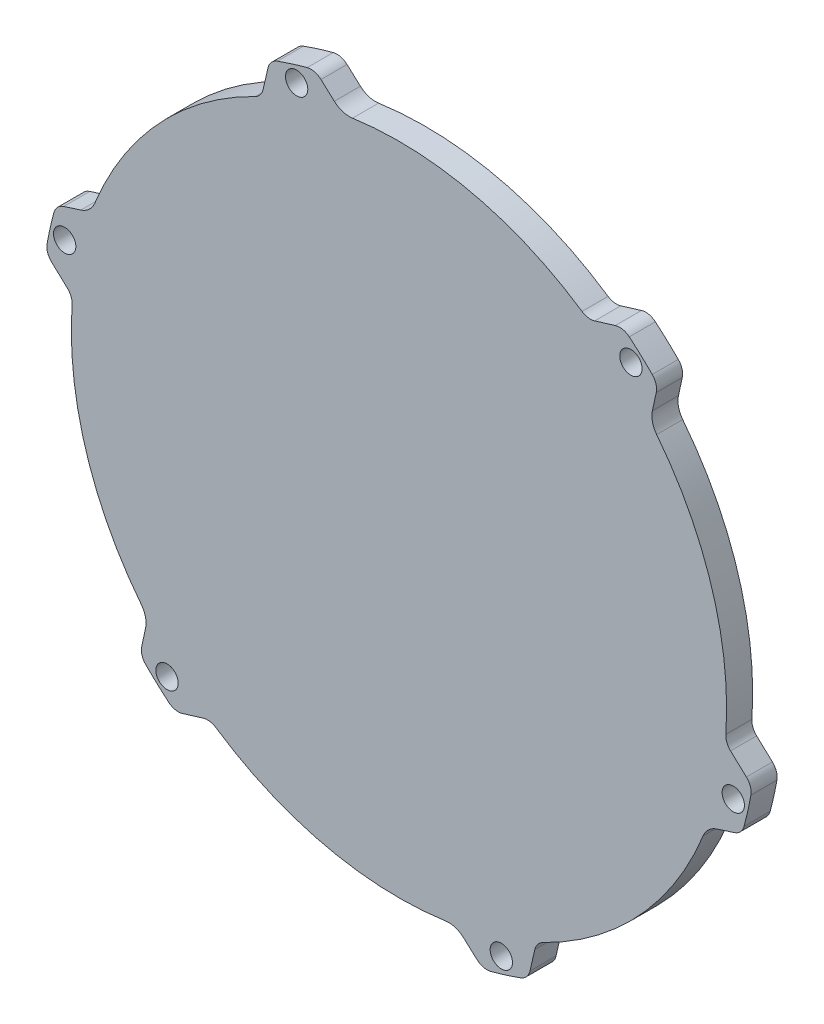
from build123d import *

# Parameters (mm, degrees)
SKETCH2_R             = 39.4
BOSS_EXTRUDE1_DEPTH   = 2
SKETCH2_R_2           = 1.5
SKETCH2_R_3           = 42
BOSS_EXTRUDE1_2_DEPTH = 2
SKETCH3_R             = 1.5
BOSS_EXTRUDE2_DEPTH   = 1.5
SKETCH4_R             = 37
CUT_EXTRUDE1_DEPTH    = 2


with BuildPart() as part:
    # Sketch2 → Boss-Extrude1 (new body)
    with BuildSketch(Plane.XY):
        Circle(SKETCH2_R)
    extrude(amount=BOSS_EXTRUDE1_DEPTH)



with BuildPart() as body_2:
    # Sketch2 → Boss-Extrude1 2 (new body)
    with BuildSketch(Plane.XY):
        with BuildLine():
            Line((-45.018479974, 13.897886094), (-42.708823016, 14.636743864))
            ThreePointArc((-42.708823016, 14.636743864), (-41.579055756, 15.298025015), (-40.838449582, 16.377455105))
            ThreePointArc((-40.838449582, 16.377455105), (-32.228172293, 29.955715826), (-19.314601011, 39.534114228))
            ThreePointArc((-19.314601011, 39.534114228), (-18.626580504, 40.087021781), (-18.243561026, 40.882241915))
            Line((-18.243561026, 40.882241915), (-17.592978184, 43.707000534))
            ThreePointArc((-17.592978184, 43.707000534), (-17.140898521, 44.584509163), (-16.324175781, 45.138910987))
            ThreePointArc((-16.324175781, 45.138910987), (-14.341791733, 45.80734668), (-12.332164177, 46.388767247))
            ThreePointArc((-12.332164177, 46.388767247), (-11.345102668, 46.399111036), (-10.473317571, 45.936090345))
            Line((-10.473317571, 45.936090345), (-8.678619493, 44.30529763))
            ThreePointArc((-8.678619493, 44.30529763), (-7.541049587, 43.657531057), (-6.235932621, 43.555862342))
            ThreePointArc((-6.235932621, 43.555862342), (9.828324748, 42.888273836), (24.580246732, 36.493992253))
            ThreePointArc((24.580246732, 36.493992253), (25.403088973, 36.174602792), (26.283279549, 36.240508262))
            Line((26.283279549, 36.240508262), (29.054883694, 37.089466303))
            ThreePointArc((29.054883694, 37.089466303), (30.04086829, 37.136708144), (30.929355724, 36.706606415))
            ThreePointArc((30.929355724, 36.706606415), (32.499430039, 35.324029316), (34.007768798, 33.874351084))
            ThreePointArc((34.007768798, 33.874351084), (34.510257536, 33.024702637), (34.545162404, 32.03820425))
            Line((34.545162404, 32.03820425), (34.030203523, 29.668553765))
            ThreePointArc((34.030203523, 29.668553765), (34.038006169, 28.359506042), (34.602516962, 27.178407237))
            ThreePointArc((34.602516962, 27.178407237), (42.05649704, 12.93255801), (43.894847743, -3.040121975))
            ThreePointArc((43.894847743, -3.040121975), (44.029669477, -3.912418989), (44.526840575, -4.641733653))
            Line((44.526840575, -4.641733653), (46.647861878, -6.617534232))
            ThreePointArc((46.647861878, -6.617534232), (47.181766811, -7.447801019), (47.253531504, -8.432304572))
            ThreePointArc((47.253531504, -8.432304572), (46.841221772, -10.483317364), (46.339932975, -12.514416163))
            ThreePointArc((46.339932975, -12.514416163), (45.855360204, -13.374408399), (45.018479974, -13.897886094))
            Line((45.018479974, -13.897886094), (42.708823016, -14.636743864))
            ThreePointArc((42.708823016, -14.636743864), (41.579055756, -15.298025015), (40.838449582, -16.377455105))
            ThreePointArc((40.838449582, -16.377455105), (32.228172293, -29.955715826), (19.314601011, -39.534114228))
            ThreePointArc((19.314601011, -39.534114228), (18.626580504, -40.087021781), (18.243561026, -40.882241915))
            Line((18.243561026, -40.882241915), (17.592978184, -43.707000534))
            ThreePointArc((17.592978184, -43.707000534), (17.140898521, -44.584509163), (16.324175781, -45.138910987))
            ThreePointArc((16.324175781, -45.138910987), (14.341791733, -45.80734668), (12.332164177, -46.388767247))
            ThreePointArc((12.332164177, -46.388767247), (11.345102668, -46.399111036), (10.473317571, -45.936090345))
            Line((10.473317571, -45.936090345), (8.678619493, -44.30529763))
            ThreePointArc((8.678619493, -44.30529763), (7.541049587, -43.657531057), (6.235932621, -43.555862342))
            ThreePointArc((6.235932621, -43.555862342), (-9.828324748, -42.888273836), (-24.580246732, -36.493992253))
            ThreePointArc((-24.580246732, -36.493992253), (-25.403088973, -36.174602792), (-26.283279549, -36.240508262))
            Line((-26.283279549, -36.240508262), (-29.054883694, -37.089466303))
            ThreePointArc((-29.054883694, -37.089466303), (-30.04086829, -37.136708144), (-30.929355724, -36.706606415))
            ThreePointArc((-30.929355724, -36.706606415), (-32.499430039, -35.324029316), (-34.007768798, -33.874351084))
            ThreePointArc((-34.007768798, -33.874351084), (-34.510257536, -33.024702637), (-34.545162404, -32.03820425))
            Line((-34.545162404, -32.03820425), (-34.030203523, -29.668553765))
            ThreePointArc((-34.030203523, -29.668553765), (-34.038006169, -28.359506042), (-34.602516962, -27.178407237))
            ThreePointArc((-34.602516962, -27.178407237), (-42.05649704, -12.93255801), (-43.894847743, 3.040121975))
            ThreePointArc((-43.894847743, 3.040121975), (-44.029669477, 3.912418989), (-44.526840575, 4.641733653))
            Line((-44.526840575, 4.641733653), (-46.647861878, 6.617534232))
            ThreePointArc((-46.647861878, 6.617534232), (-47.181766811, 7.447801019), (-47.253531504, 8.432304572))
            ThreePointArc((-47.253531504, 8.432304572), (-46.841221772, 10.483317364), (-46.339932975, 12.514416163))
            ThreePointArc((-46.339932975, 12.514416163), (-45.855360204, 13.374408399), (-45.018479974, 13.897886094))
        make_face()
        with Locations((-13.744217077, 43.898707235)):
            Circle(SKETCH2_R_2, mode=Mode.SUBTRACT)
        with Locations((-44.889504198, 10.046512474)):
            Circle(SKETCH2_R_2, mode=Mode.SUBTRACT)
        with Locations((31.145287121, 33.852194762)):
            Circle(SKETCH2_R_2, mode=Mode.SUBTRACT)
        with Locations((44.889504198, -10.046512474)):
            Circle(SKETCH2_R_2, mode=Mode.SUBTRACT)
        with Locations((13.744217077, -43.898707235)):
            Circle(SKETCH2_R_2, mode=Mode.SUBTRACT)
        with Locations((-31.145287121, -33.852194762)):
            Circle(SKETCH2_R_2, mode=Mode.SUBTRACT)
        Circle(SKETCH2_R_3, mode=Mode.SUBTRACT)
    extrude(amount=BOSS_EXTRUDE1_2_DEPTH)


with BuildPart() as part_1:
    add(part.part)

    add(body_2.part)  # Boss-Extrude2 merges body 2
    # Sketch3 → Boss-Extrude2 (add)
    with BuildSketch(Plane.XY.offset(2)):
        with BuildLine():
            Line((8.678619493, -44.30529763), (10.473317571, -45.936090345))
            ThreePointArc((10.473317571, -45.936090345), (11.345102668, -46.399111036), (12.332164177, -46.388767247))
            ThreePointArc((12.332164177, -46.388767247), (14.341791733, -45.80734668), (16.324175781, -45.138910987))
            ThreePointArc((16.324175781, -45.138910987), (17.140898521, -44.584509163), (17.592978184, -43.707000534))
            Line((17.592978184, -43.707000534), (18.243561026, -40.882241915))
            ThreePointArc((18.243561026, -40.882241915), (18.626580504, -40.087021781), (19.314601011, -39.534114228))
            ThreePointArc((19.314601011, -39.534114228), (32.228172293, -29.955715826), (40.838449582, -16.377455105))
            ThreePointArc((40.838449582, -16.377455105), (41.579055756, -15.298025015), (42.708823016, -14.636743864))
            Line((42.708823016, -14.636743864), (45.018479974, -13.897886094))
            ThreePointArc((45.018479974, -13.897886094), (45.855360204, -13.374408399), (46.339932975, -12.514416163))
            ThreePointArc((46.339932975, -12.514416163), (46.841221772, -10.483317364), (47.253531504, -8.432304572))
            ThreePointArc((47.253531504, -8.432304572), (47.181766811, -7.447801019), (46.647861878, -6.617534232))
            Line((46.647861878, -6.617534232), (44.526840575, -4.641733653))
            ThreePointArc((44.526840575, -4.641733653), (44.029669477, -3.912418989), (43.894847743, -3.040121975))
            ThreePointArc((43.894847743, -3.040121975), (42.05649704, 12.93255801), (34.602516962, 27.178407237))
            ThreePointArc((34.602516962, 27.178407237), (34.038006169, 28.359506042), (34.030203523, 29.668553765))
            Line((34.030203523, 29.668553765), (34.545162404, 32.03820425))
            ThreePointArc((34.545162404, 32.03820425), (34.510257536, 33.024702637), (34.007768798, 33.874351084))
            ThreePointArc((34.007768798, 33.874351084), (32.499430039, 35.324029316), (30.929355724, 36.706606415))
            ThreePointArc((30.929355724, 36.706606415), (30.04086829, 37.136708144), (29.054883694, 37.089466303))
            Line((29.054883694, 37.089466303), (26.283279549, 36.240508262))
            ThreePointArc((26.283279549, 36.240508262), (25.403088973, 36.174602792), (24.580246732, 36.493992253))
            ThreePointArc((24.580246732, 36.493992253), (9.828324748, 42.888273836), (-6.235932621, 43.555862342))
            ThreePointArc((-6.235932621, 43.555862342), (-7.541049587, 43.657531057), (-8.678619493, 44.30529763))
            Line((-8.678619493, 44.30529763), (-10.473317571, 45.936090345))
            ThreePointArc((-10.473317571, 45.936090345), (-11.345102668, 46.399111036), (-12.332164177, 46.388767247))
            ThreePointArc((-12.332164177, 46.388767247), (-14.341791733, 45.80734668), (-16.324175781, 45.138910987))
            ThreePointArc((-16.324175781, 45.138910987), (-17.140898521, 44.584509163), (-17.592978184, 43.707000534))
            Line((-17.592978184, 43.707000534), (-18.243561026, 40.882241915))
            ThreePointArc((-18.243561026, 40.882241915), (-18.626580504, 40.087021781), (-19.314601011, 39.534114228))
            ThreePointArc((-19.314601011, 39.534114228), (-32.228172293, 29.955715826), (-40.838449582, 16.377455105))
            ThreePointArc((-40.838449582, 16.377455105), (-41.579055756, 15.298025015), (-42.708823016, 14.636743864))
            Line((-42.708823016, 14.636743864), (-45.018479974, 13.897886094))
            ThreePointArc((-45.018479974, 13.897886094), (-45.855360204, 13.374408399), (-46.339932975, 12.514416163))
            ThreePointArc((-46.339932975, 12.514416163), (-46.841221772, 10.483317364), (-47.253531504, 8.432304572))
            ThreePointArc((-47.253531504, 8.432304572), (-47.181766811, 7.447801019), (-46.647861878, 6.617534232))
            Line((-46.647861878, 6.617534232), (-44.526840575, 4.641733653))
            ThreePointArc((-44.526840575, 4.641733653), (-44.029669477, 3.912418989), (-43.894847743, 3.040121975))
            ThreePointArc((-43.894847743, 3.040121975), (-42.05649704, -12.93255801), (-34.602516962, -27.178407237))
            ThreePointArc((-34.602516962, -27.178407237), (-34.038006169, -28.359506042), (-34.030203523, -29.668553765))
            Line((-34.030203523, -29.668553765), (-34.545162404, -32.03820425))
            ThreePointArc((-34.545162404, -32.03820425), (-34.510257536, -33.024702637), (-34.007768798, -33.874351084))
            ThreePointArc((-34.007768798, -33.874351084), (-32.499430039, -35.324029316), (-30.929355724, -36.706606415))
            ThreePointArc((-30.929355724, -36.706606415), (-30.04086829, -37.136708144), (-29.054883694, -37.089466303))
            Line((-29.054883694, -37.089466303), (-26.283279549, -36.240508262))
            ThreePointArc((-26.283279549, -36.240508262), (-25.403088973, -36.174602792), (-24.580246732, -36.493992253))
            ThreePointArc((-24.580246732, -36.493992253), (-9.828324748, -42.888273836), (6.235932621, -43.555862342))
            ThreePointArc((6.235932621, -43.555862342), (7.541049587, -43.657531057), (8.678619493, -44.30529763))
        make_face()
        with Locations((-13.744217077, 43.898707235)):
            Circle(SKETCH3_R, mode=Mode.SUBTRACT)
        with Locations((31.145287121, 33.852194762)):
            Circle(SKETCH3_R, mode=Mode.SUBTRACT)
        with Locations((-44.889504198, 10.046512474)):
            Circle(SKETCH3_R, mode=Mode.SUBTRACT)
        with Locations((-31.145287121, -33.852194762)):
            Circle(SKETCH3_R, mode=Mode.SUBTRACT)
        with Locations((13.744217077, -43.898707235)):
            Circle(SKETCH3_R, mode=Mode.SUBTRACT)
        with Locations((44.889504198, -10.046512474)):
            Circle(SKETCH3_R, mode=Mode.SUBTRACT)
    extrude(amount=BOSS_EXTRUDE2_DEPTH)

    # Sketch4 → Cut-Extrude1 (cut)
    with BuildSketch(Plane(origin=(0, 0, 0), x_dir=(-1, 0, 0), z_dir=(0, 0, -1))):
        Circle(SKETCH4_R)
    extrude(amount=-CUT_EXTRUDE1_DEPTH, mode=Mode.SUBTRACT)


solid = part_1.part
